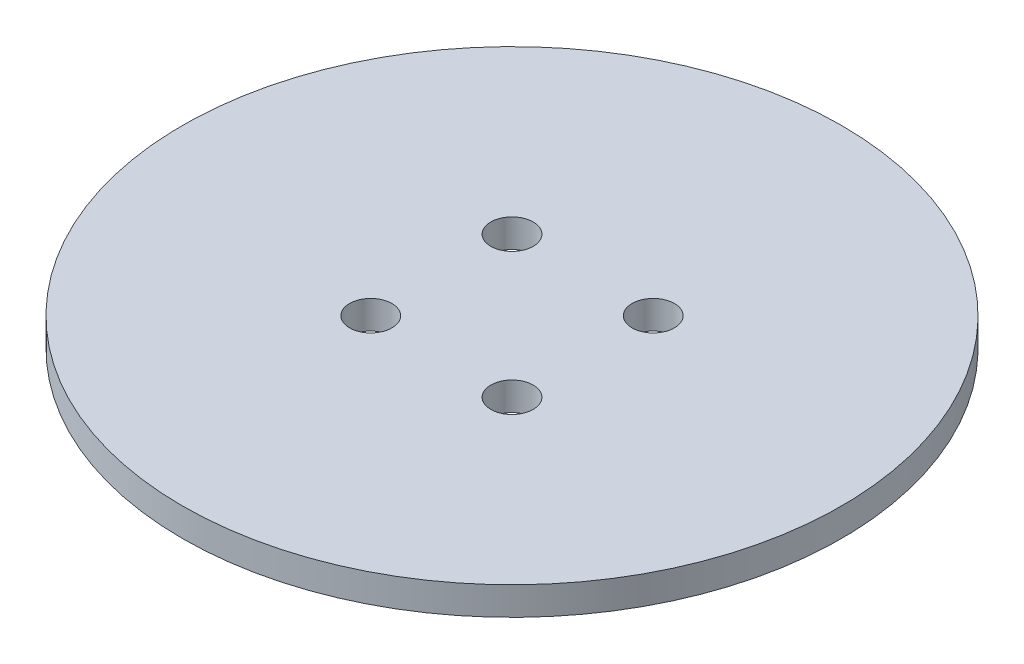
from build123d import *

# Parameters (mm, degrees)
SKETCH1_R             = 35
BOSS_EXTRUDE1_DEPTH   = 3
F_8_CLEARANCE_HOLE1_D = 4.4958


with BuildPart() as part:
    # Sketch1 → Boss-Extrude1 (new body)
    with BuildSketch(Plane(origin=(0, 0, 0), x_dir=(1, 0, 0), z_dir=(0, 1, 0))):
        with Locations(Location((0, 0, 0), (0, 0, 270))):
            Circle(SKETCH1_R)
    extrude(amount=BOSS_EXTRUDE1_DEPTH)

    # #8 Clearance Hole1 (through all)
    with Locations(Plane(origin=(0, 3, 0), x_dir=(1, 0, 0), z_dir=(0, 1, 0))):
        with Locations((-7.5, 7.5), (7.5, 7.5), (-7.5, -7.5), (7.5, -7.5)):
            Hole(F_8_CLEARANCE_HOLE1_D / 2)


solid = part.part
